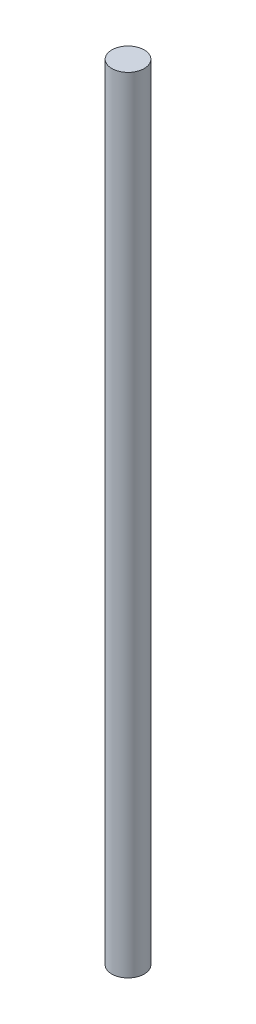
from build123d import *

# Parameters (mm, degrees)
SKETCH1_R           = 4
BOSS_EXTRUDE1_DEPTH = 194


with BuildPart() as part:
    # Sketch1 → Boss-Extrude1 (new body)
    with BuildSketch(Plane(origin=(0, 0, 0), x_dir=(1, 0, 0), z_dir=(0, 1, 0))):
        with Locations(Location((0, 0, 0), (0, 0, 90))):
            Circle(SKETCH1_R)
    extrude(amount=BOSS_EXTRUDE1_DEPTH)


solid = part.part
